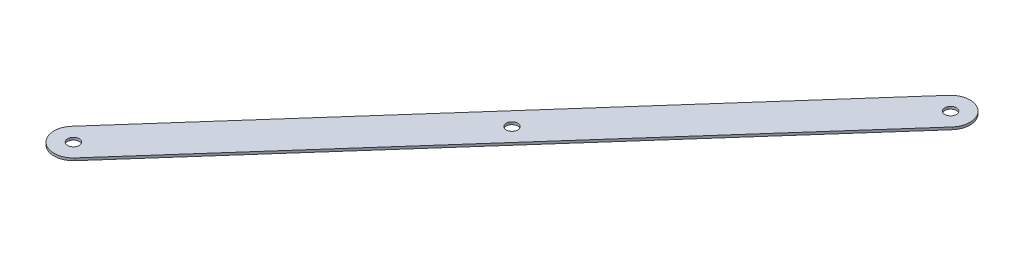
from build123d import *

# Parameters (mm, degrees)
SKETCH1_R           = 3.81
BOSS_EXTRUDE1_DEPTH = 1.5875


with BuildPart() as part:
    # Sketch1 → Boss-Extrude1 (new body)
    with BuildSketch(Plane(origin=(0, 0, 0), x_dir=(1, 0, 0), z_dir=(0, 1, 0))):
        with BuildLine():
            Line((-9.511548238, 8.415488704), (259.784090278, 312.785032312))
            ThreePointArc((259.784090278, 312.785032312), (277.71112722, 313.881091846), (278.807186754, 295.954054905))
            Line((278.807186754, 295.954054905), (9.511548238, -8.415488704))
            ThreePointArc((9.511548238, -8.415488704), (-8.415488704, -9.511548238), (-9.511548238, 8.415488704))
        make_face()
        with Locations(Location((134.647819258, 152.184771804, 0), (0, 0, 270))):
            Circle(SKETCH1_R, mode=Mode.SUBTRACT)
        with Locations(Location((269.295638516, 304.369543608, 0), (0, 0, 270))):
            Circle(SKETCH1_R, mode=Mode.SUBTRACT)
        with Locations(Location((0, 0, 0), (0, 0, 270))):
            Circle(SKETCH1_R, mode=Mode.SUBTRACT)
    extrude(amount=BOSS_EXTRUDE1_DEPTH)


solid = part.part
